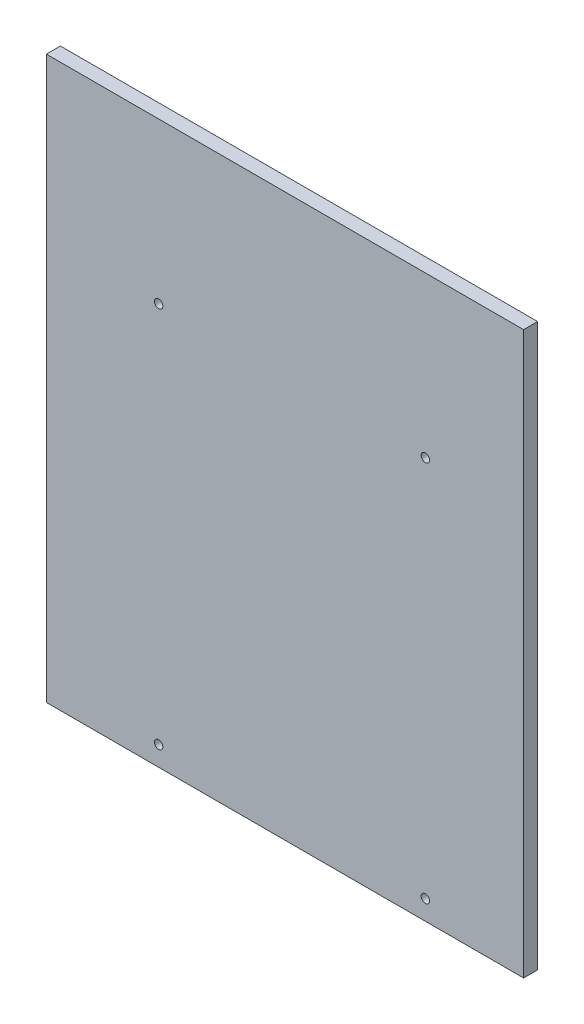
from build123d import *

# Parameters (mm, degrees)
SKETCH1_W           = 170
SKETCH1_H           = 200
SKETCH1_R           = 1.5
BOSS_EXTRUDE1_DEPTH = 5


with BuildPart() as part:
    # Sketch1 → Boss-Extrude1 (new body)
    with BuildSketch(Plane.XY):
        Rectangle(SKETCH1_W, SKETCH1_H)
        with Locations((-45, 43)):
            Circle(SKETCH1_R, mode=Mode.SUBTRACT)
        with Locations((50, 43)):
            Circle(SKETCH1_R, mode=Mode.SUBTRACT)
        with Locations((50, -93)):
            Circle(SKETCH1_R, mode=Mode.SUBTRACT)
        with Locations((-45, -93)):
            Circle(SKETCH1_R, mode=Mode.SUBTRACT)
    extrude(amount=BOSS_EXTRUDE1_DEPTH)


solid = part.part
